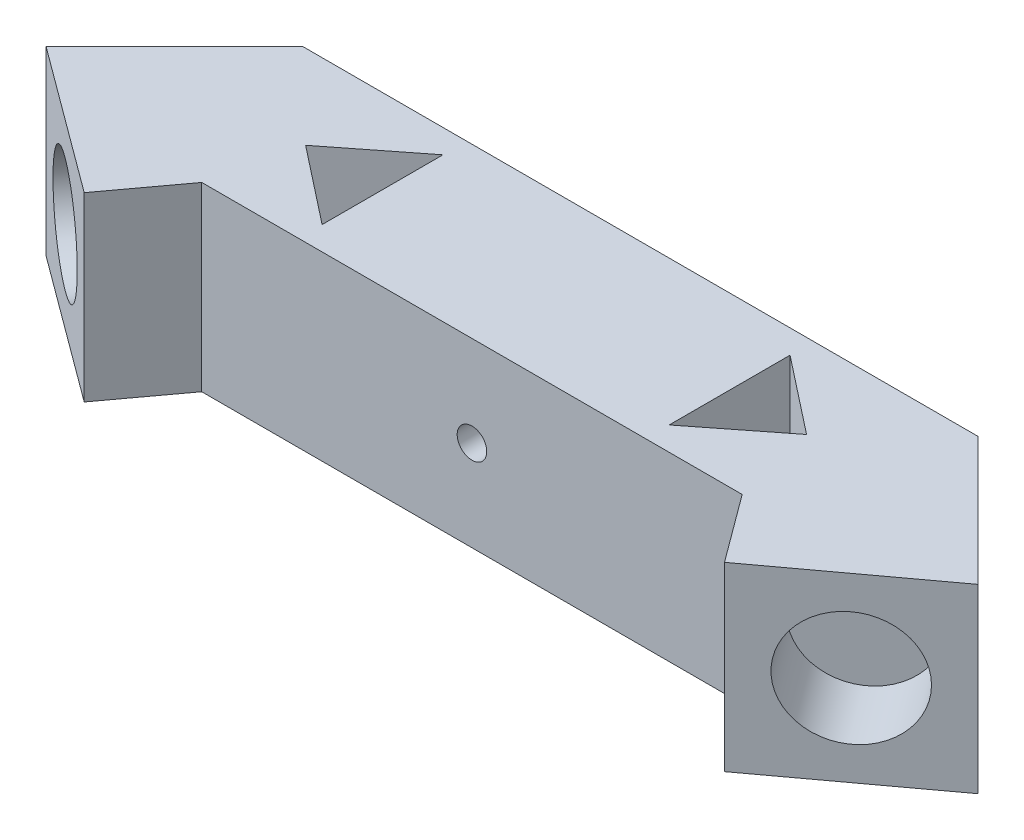
from build123d import *

# Parameters (mm, degrees)
BOSS_EXTRUDE1_DEPTH = 38.1
SKETCH2_R           = 12.065
CUT_EXTRUDE1_DEPTH  = 15.24
SKETCH3_R           = 12.065
CUT_EXTRUDE2_DEPTH  = 15.24
CUT_EXTRUDE3_DEPTH  = 38.1
SKETCH6_R           = 3.1115
CUT_EXTRUDE4_DEPTH  = 46.482


with BuildPart() as part:
    # Sketch1 → Boss-Extrude1 (new body)
    with BuildSketch(Plane(origin=(0, 0, 0), x_dir=(1, 0, 0), z_dir=(0, 1, 0))):
        Polygon((0, 0), (113.579665808, 0), (124.068494586, -14.211767965), (154.723601267, 8.412874228), (127.782832904, 35.353642591), (-14.203167096, 35.353642591), (-41.143935459, 8.412874228), (-10.488828778, -14.211767965), align=None)
    extrude(amount=BOSS_EXTRUDE1_DEPTH)

    # Sketch2 → Cut-Extrude1 (cut)
    with BuildSketch(Plane(origin=(-10.488828778, 0, 14.211767965), x_dir=(0.8045959758833214, 0, 0.5938226297408727), z_dir=(-0.5938226297408727, 0, 0.8045959758833214))):
        with Locations((-19.05, 19.05)):
            Circle(SKETCH2_R)
    extrude(amount=-CUT_EXTRUDE1_DEPTH, mode=Mode.SUBTRACT)

    # Sketch3 → Cut-Extrude2 (cut)
    with BuildSketch(Plane(origin=(50.539894278, 0, 68.478689631), x_dir=(0.8045959758833213, 0, -0.5938226297408729), z_dir=(0.5938226297408729, 0, 0.8045959758833213))):
        with Locations((110.435742051, 19.05)):
            Circle(SKETCH3_R)
    extrude(amount=-CUT_EXTRUDE2_DEPTH, mode=Mode.SUBTRACT)

    # Sketch5 → Cut-Extrude3 (cut)
    with BuildSketch(Plane(origin=(0, 38.1, 0), x_dir=(1, 0, 0), z_dir=(0, 1, 0))):
        Polygon((4.151555437, 17.676821295), (20.32, 30.376821295), (20.32, 4.976821295), align=None)
        Polygon((93.259665808, 30.376821295), (93.259665808, 4.976821295), (109.428110371, 17.676821295), align=None)
    extrude(amount=-CUT_EXTRUDE3_DEPTH, mode=Mode.SUBTRACT)

    # Sketch6 → Cut-Extrude4 (cut)
    with BuildSketch(Plane(origin=(0, 0, -35.353642591), x_dir=(-1, 0, 0), z_dir=(0, 0, -1))):
        with Locations((-56.789832904, 19.05)):
            Circle(SKETCH6_R)
    extrude(amount=-CUT_EXTRUDE4_DEPTH, mode=Mode.SUBTRACT)


solid = part.part
